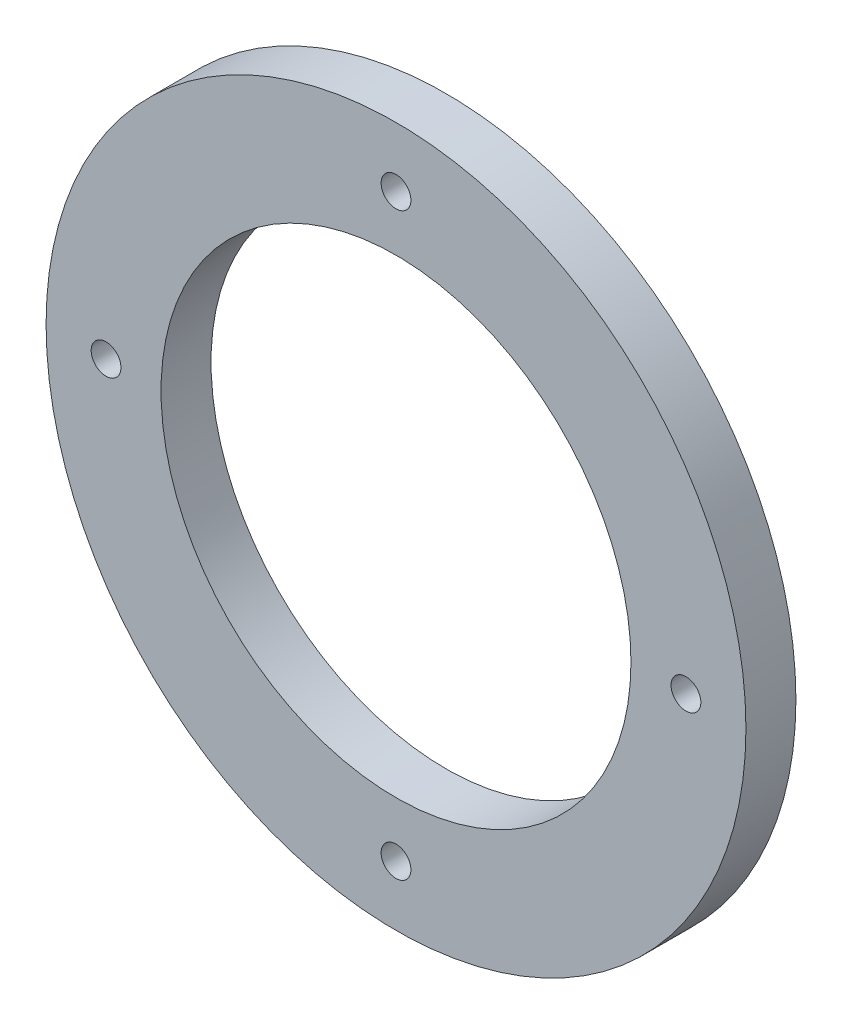
from build123d import *

# Parameters (mm, degrees)
SKETCH1_R           = 35
SKETCH1_R_2         = 23.5
SKETCH1_R_3         = 1.49
BOSS_EXTRUDE1_DEPTH = 5


with BuildPart() as part:
    # Sketch1 → Boss-Extrude1 (new body)
    with BuildSketch(Plane.XY):
        Circle(SKETCH1_R)
        Circle(SKETCH1_R_2, mode=Mode.SUBTRACT)
        with Locations((29, 0)):
            Circle(SKETCH1_R_3, mode=Mode.SUBTRACT)
        with Locations((0, 29)):
            Circle(SKETCH1_R_3, mode=Mode.SUBTRACT)
        with Locations((-29, 0)):
            Circle(SKETCH1_R_3, mode=Mode.SUBTRACT)
        with Locations((0, -29)):
            Circle(SKETCH1_R_3, mode=Mode.SUBTRACT)
    extrude(amount=BOSS_EXTRUDE1_DEPTH)


solid = part.part
